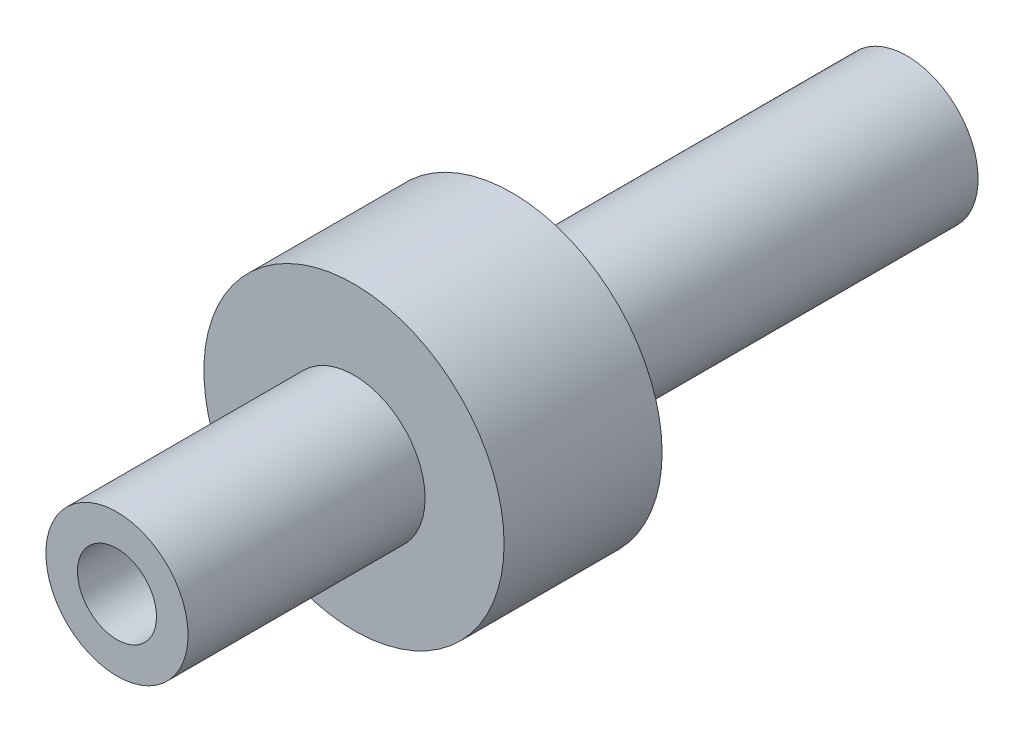
from build123d import *

# Parameters (mm, degrees)
SKETCH1_R           = 4.75
BOSS_EXTRUDE1_DEPTH = 5
SKETCH2_R           = 2.25
BOSS_EXTRUDE2_DEPTH = 7.5
BOSS_EXTRUDE3_START = 12.5
SKETCH3_R           = 2.25
BOSS_EXTRUDE3_DEPTH = 12.5
SKETCH4_R           = 1.25
CUT_EXTRUDE1_DEPTH  = 5
CUT_EXTRUDE2_START  = -5
SKETCH5_R           = 1.25
CUT_EXTRUDE2_DEPTH  = 5


with BuildPart() as part:
    # Sketch1 → Boss-Extrude1 (new body)
    with BuildSketch(Plane.XY):
        Circle(SKETCH1_R)
    extrude(amount=BOSS_EXTRUDE1_DEPTH)

    # Sketch2 → Boss-Extrude2 (add)
    with BuildSketch(Plane.XY.offset(5)):
        Circle(SKETCH2_R)
    extrude(amount=BOSS_EXTRUDE2_DEPTH)

    # Sketch3 → Boss-Extrude3 (add)
    with BuildSketch(Plane(origin=(0, 0, 0), x_dir=(-1, 0, 0), z_dir=(0, 0, -1)).offset(BOSS_EXTRUDE3_START)):
        with Locations(Location((0, 0, 0), (0, 0, 180))):
            Circle(SKETCH3_R)
    extrude(amount=-BOSS_EXTRUDE3_DEPTH)

    # Sketch4 → Cut-Extrude1 (cut)
    with BuildSketch(Plane.XY.offset(12.5)):
        Circle(SKETCH4_R)
    extrude(amount=-CUT_EXTRUDE1_DEPTH, mode=Mode.SUBTRACT)

    # Sketch5 → Cut-Extrude2 (cut)
    with BuildSketch(Plane(origin=(0, 0, -12.5), x_dir=(-1, 0, 0), z_dir=(0, 0, -1)).offset(CUT_EXTRUDE2_START)):
        with Locations(Location((0, 0, 0), (0, 0, 180))):
            Circle(SKETCH5_R)
    extrude(amount=CUT_EXTRUDE2_DEPTH, mode=Mode.SUBTRACT)


solid = part.part
